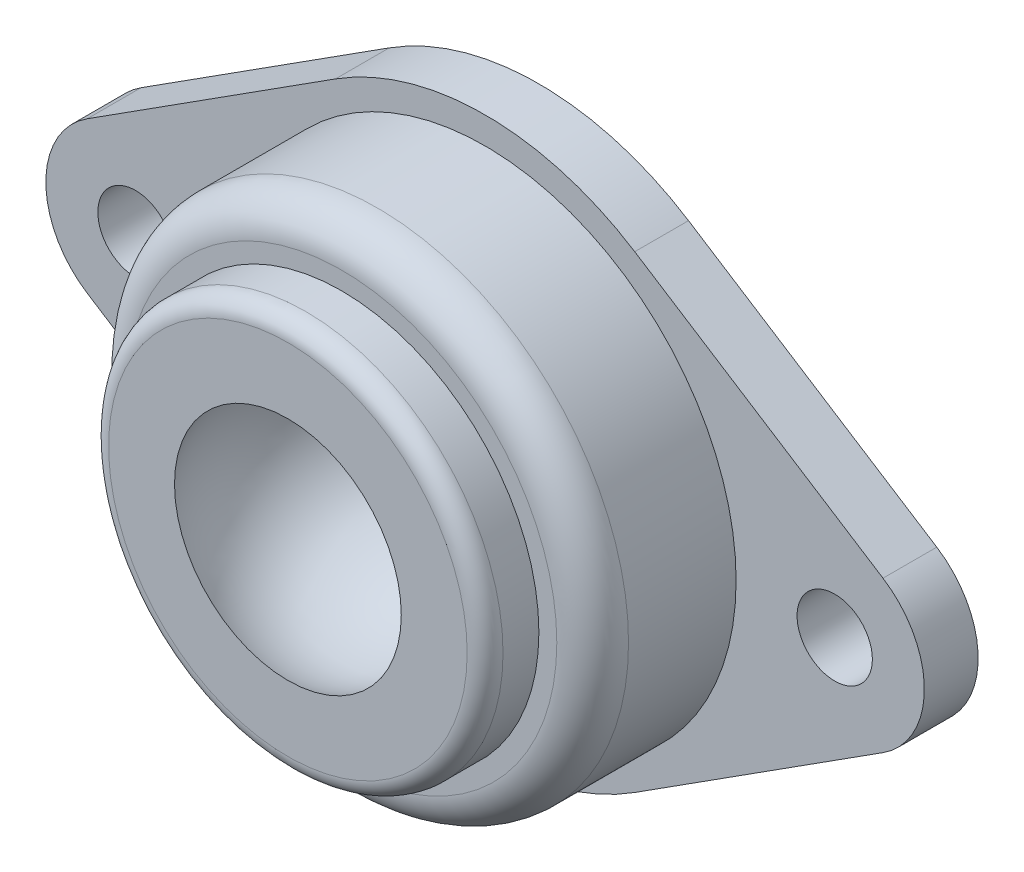
from build123d import *

# Parameters (mm, degrees)
SKETCH_1_R      = 2.1
EXTRUDE_1_DEPTH = 3
SKETCH_2_R      = 14
EXTRUDE_2_DEPTH = 8
SKETCH_3_R      = 11
EXTRUDE_3_DEPTH = 3
FILLET_1_R      = 2
FILLET_2_R      = 1


with BuildPart() as part:
    # 草图1 → 凸台-拉伸1 (new body)
    with BuildSketch(Plane.XY):
        with BuildLine():
            Line((-22.192307692, 4.213250442), (-8.346153846, 13.061076371))
            ThreePointArc((-8.346153846, 13.061076371), (0, 15.5), (8.346153846, 13.061076371))
            Line((8.346153846, 13.061076371), (22.192307692, 4.213250442))
            ThreePointArc((22.192307692, 4.213250442), (24.5, 0), (22.192307692, -4.213250442))
            Line((22.192307692, -4.213250442), (8.346153846, -13.061076371))
            ThreePointArc((8.346153846, -13.061076371), (0, -15.5), (-8.346153846, -13.061076371))
            Line((-8.346153846, -13.061076371), (-22.192307692, -4.213250442))
            ThreePointArc((-22.192307692, -4.213250442), (-24.5, 0), (-22.192307692, 4.213250442))
        make_face()
        with Locations((-19.5, 0)):
            Circle(SKETCH_1_R, mode=Mode.SUBTRACT)
        with Locations((19.5, 0)):
            Circle(SKETCH_1_R, mode=Mode.SUBTRACT)
    extrude(amount=EXTRUDE_1_DEPTH)

    # 草图2 → 凸台-拉伸2 (add)
    with BuildSketch(Plane.XY.offset(3)):
        Circle(SKETCH_2_R)
    extrude(amount=EXTRUDE_2_DEPTH)

    # 草图3 → 凸台-拉伸3 (add)
    with BuildSketch(Plane.XY.offset(11)):
        Circle(SKETCH_3_R)
    extrude(amount=EXTRUDE_3_DEPTH)

    # 草图4 → 切除-旋转1 (revolve, cut)
    with BuildSketch(Plane(origin=(0, 0, 0), x_dir=(0, 0, -1), z_dir=(1, 0, 0))):
        with BuildLine():
            Line((-18, 0), (-4, 0))
            ThreePointArc((-4, 0), (-11, 7), (-18, 0))
        make_face()
    revolve(axis=Axis((0, 0, 18), (0, 0, -1)), mode=Mode.SUBTRACT)

    # 圆角1
    fillet_1_edges = [part.edges().sort_by_distance(p)[0] for p in [
        (-14, 0, 11),
    ]]
    fillet(fillet_1_edges, radius=FILLET_1_R)

    # 圆角2
    fillet_2_edges = [part.edges().sort_by_distance(p)[0] for p in [
        (-11, 0, 14),
    ]]
    fillet(fillet_2_edges, radius=FILLET_2_R)


solid = part.part
